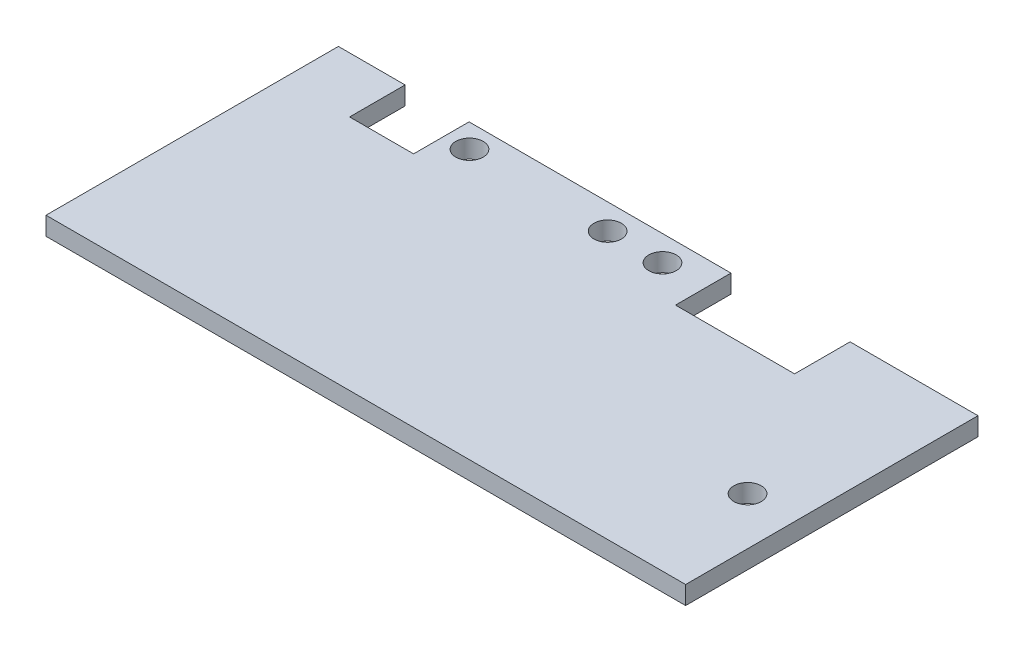
from build123d import *

# Parameters (mm, degrees)
BOSS_EXTRUDE1_DEPTH     = 1
SKETCH3_R               = 0.75
CUT_EXTRUDE2_DEPTH      = 39.49675311
CUT_EXTRUDE3_DEPTH      = 39.49675311
CUT_EXTRUDE3_DEPTH_BACK = 39.49675311
SKETCH4_R               = 0.75


with BuildPart() as part:
    # Sketch1 → Boss-Extrude1 (new body)
    with BuildSketch(Plane(origin=(0, 0, 0), x_dir=(1, 0, 0), z_dir=(0, 1, 0))):
        Polygon((0, 0), (0, 16), (3.65, 16), (3.65, 12.964), (7.15, 12.964), (7.15, 16), (21.483, 16), (21.483, 12.964), (28, 12.964), (28, 16), (35, 16), (35, 0), align=None)
    extrude(amount=BOSS_EXTRUDE1_DEPTH)

    # Sketch3 → Cut-Extrude2 (cut, through all)
    with BuildSketch(Plane(origin=(0, 1, 0), x_dir=(1, 0, 0), z_dir=(0, 1, 0))):
        with Locations(Location((32.39, 6, 0), (0, 0, 270))):
            Circle(SKETCH3_R)
    extrude(amount=-CUT_EXTRUDE2_DEPTH, mode=Mode.SUBTRACT)

    # Sketch4 → Cut-Extrude3 (cut, two sides: drawn at the far end of the back side and taken through both)
    with BuildSketch(Plane(origin=(0, 1, 0), x_dir=(1, 0, 0), z_dir=(0, 1, 0)).offset(-CUT_EXTRUDE3_DEPTH_BACK)):
        with Locations(Location((8.46, 14.713, 0), (0, 0, 270))):
            Circle(SKETCH4_R)
        with Locations(Location((16.121, 14.613, 0), (0, 0, 270))):
            Circle(SKETCH4_R)
        with Locations(Location((19.121, 14.613, 0), (0, 0, 270))):
            Circle(SKETCH4_R)
    extrude(amount=CUT_EXTRUDE3_DEPTH + CUT_EXTRUDE3_DEPTH_BACK, mode=Mode.SUBTRACT)


solid = part.part
